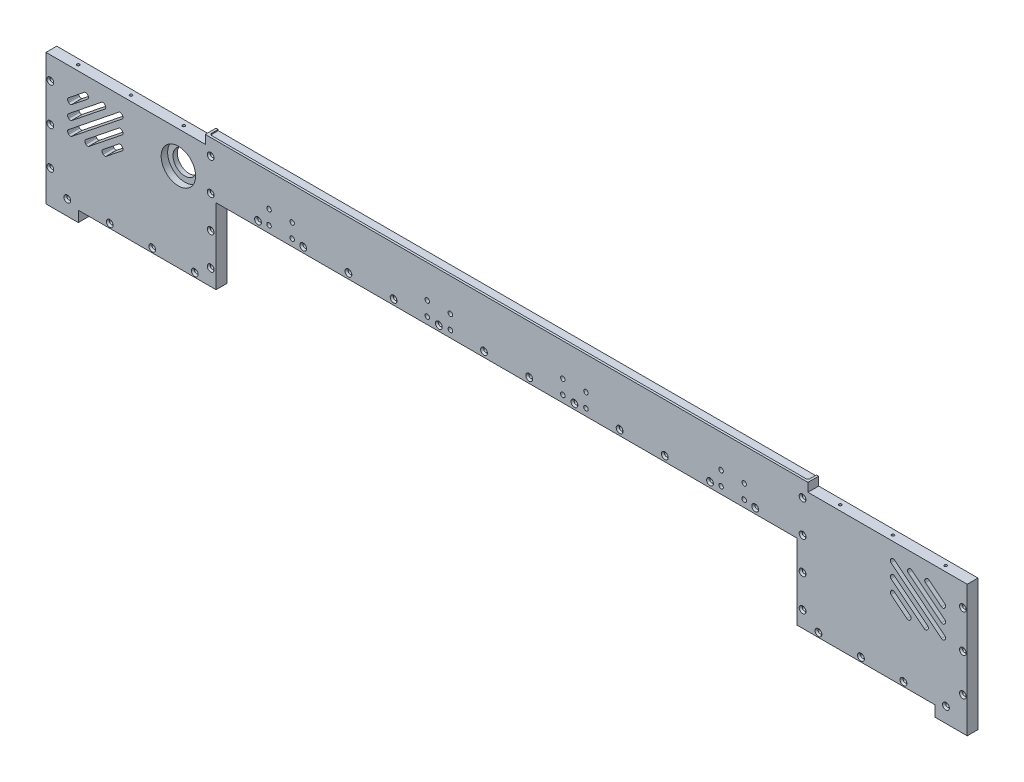
from build123d import *

# Parameters (mm, degrees)
BOSS_EXTRUDE1_DEPTH                          = 10
M3X0_5_TAPPED_HOLE1_AT_2_COUNT               = 2
M3X0_5_TAPPED_HOLE1_AT_2_PITCH               = 49
M3X0_5_TAPPED_HOLE1_AT_3_COUNT               = 2
M3X0_5_TAPPED_HOLE1_AT_3_PITCH               = 98
CSK_FOR_M3_COUNTERSUNK_FLAT_HEAD1_AT_2_COUNT = 2
CSK_FOR_M3_COUNTERSUNK_FLAT_HEAD1_AT_2_PITCH = 39.5
CSK_FOR_M3_COUNTERSUNK_FLAT_HEAD1_AT_3_COUNT = 2
CSK_FOR_M3_COUNTERSUNK_FLAT_HEAD1_AT_3_PITCH = 79
CSK_FOR_M3_COUNTERSUNK_FLAT_HEAD1_AT_4_COUNT = 2
CSK_FOR_M3_COUNTERSUNK_FLAT_HEAD1_AT_4_PITCH = 118.5
CSK_FOR_M3_COUNTERSUNK_FLAT_HEAD2_AT_2_COUNT = 2
CSK_FOR_M3_COUNTERSUNK_FLAT_HEAD2_AT_2_PITCH = 35
CSK_FOR_M3_COUNTERSUNK_FLAT_HEAD2_AT_3_COUNT = 2
CSK_FOR_M3_COUNTERSUNK_FLAT_HEAD2_AT_3_PITCH = 70
CSK_FOR_M3_COUNTERSUNK_FLAT_HEAD3_AT_2_COUNT = 2
CSK_FOR_M3_COUNTERSUNK_FLAT_HEAD3_AT_2_PITCH = 30
CSK_FOR_M3_COUNTERSUNK_FLAT_HEAD3_AT_3_COUNT = 2
CSK_FOR_M3_COUNTERSUNK_FLAT_HEAD3_AT_3_PITCH = 60
CSK_FOR_M3_COUNTERSUNK_FLAT_HEAD3_AT_4_COUNT = 2
CSK_FOR_M3_COUNTERSUNK_FLAT_HEAD3_AT_4_PITCH = 90
CSK_FOR_M3_COUNTERSUNK_FLAT_HEAD4_AT_2_COUNT = 2
CSK_FOR_M3_COUNTERSUNK_FLAT_HEAD4_AT_2_PITCH = 42
CSK_FOR_M3_COUNTERSUNK_FLAT_HEAD4_AT_3_COUNT = 2
CSK_FOR_M3_COUNTERSUNK_FLAT_HEAD4_AT_3_PITCH = 84
CSK_FOR_M3_COUNTERSUNK_FLAT_HEAD4_AT_4_COUNT = 2
CSK_FOR_M3_COUNTERSUNK_FLAT_HEAD4_AT_4_PITCH = 126
CSK_FOR_M3_COUNTERSUNK_FLAT_HEAD4_AT_5_COUNT = 2
CSK_FOR_M3_COUNTERSUNK_FLAT_HEAD4_AT_5_PITCH = 168
CSK_FOR_M3_COUNTERSUNK_FLAT_HEAD4_AT_6_COUNT = 2
CSK_FOR_M3_COUNTERSUNK_FLAT_HEAD4_AT_6_PITCH = 210
SKETCH14_W                                   = 556
SKETCH14_H                                   = 8
CUT_EXTRUDE1_DEPTH                           = 1
FILLET1_R                                    = 2
SKETCH15_R                                   = 16
CUT_EXTRUDE2_DEPTH                           = 6
SKETCH16_R                                   = 11
CUT_EXTRUDE3_DEPTH                           = 436.453786297
M5X0_8_TAPPED_HOLE1_D                        = 4.2
LPATTERN3_COUNT                              = 2
LPATTERN3_PITCH                              = 147
MIRROR2_COPY_1_D                             = 4.2
CUT_EXTRUDE_THIN1_START                      = -10
CUT_EXTRUDE_THIN1_DEPTH                      = 446.527266655
FILLET2_R                                    = 2
FILLET2_OF_MIRROR3_R                         = 2


with BuildPart() as part:
    # Sketch1 → Boss-Extrude1 (new body)
    with BuildSketch(Plane.XY):
        Polygon((270, 0), (-270, 0), (-270, -70), (-398, -70), (-398, -80), (-428, -80), (-428, 42), (-280, 42), (-280, 50), (280, 50), (280, 42), (428, 42), (428, -80), (398, -80), (398, -70), (270, -70), align=None)
    extrude(amount=BOSS_EXTRUDE1_DEPTH)

    # Sketch4 → M3x0.5 Tapped Hole1 (revolve, cut)
    with BuildSketch(Plane(origin=(-403, 42, 5), x_dir=(0, 0, 1), z_dir=(1, 0, 0))):
        Polygon((0, 0), (0, 12.251075774), (1.25, 11.5), (1.25, 0), align=None)
    m3x0_5_tapped_hole1 = revolve(axis=Axis((-403, 48.35, 5), (0, -1, 0)), mode=Mode.SUBTRACT)

    # M3x0.5 Tapped Hole1 at 2: M3x0.5 Tapped Hole1 ×2
    with Locations(*[(i * M3X0_5_TAPPED_HOLE1_AT_2_PITCH, 0, 0) for i in range(1, M3X0_5_TAPPED_HOLE1_AT_2_COUNT)]):
        add(m3x0_5_tapped_hole1, mode=Mode.SUBTRACT)

    # M3x0.5 Tapped Hole1 at 3: M3x0.5 Tapped Hole1 ×2
    with Locations(*[(i * M3X0_5_TAPPED_HOLE1_AT_3_PITCH, 0, 0) for i in range(1, M3X0_5_TAPPED_HOLE1_AT_3_COUNT)]):
        add(m3x0_5_tapped_hole1, mode=Mode.SUBTRACT)

    # Sketch6 → CSK for M3 Countersunk Flat Head1 (revolve, cut)
    with BuildSketch(Plane(origin=(-408.25, -66, 10), x_dir=(0, -1, 0), z_dir=(1, 0, 0))):
        Polygon((0, 0), (0, 12.521463052), (1.7, 11.5), (1.7, 1.45), (3.15, 0), align=None)
    csk_for_m3_countersunk_flat_head1 = revolve(axis=Axis((-408.25, -66, 16.35), (0, 0, -1)), mode=Mode.SUBTRACT)

    # CSK for M3 Countersunk Flat Head1 at 2: CSK for M3 Countersunk Flat Head1 ×2
    with Locations(*[(i * CSK_FOR_M3_COUNTERSUNK_FLAT_HEAD1_AT_2_PITCH, 0, 0) for i in range(1, CSK_FOR_M3_COUNTERSUNK_FLAT_HEAD1_AT_2_COUNT)]):
        add(csk_for_m3_countersunk_flat_head1, mode=Mode.SUBTRACT)

    # CSK for M3 Countersunk Flat Head1 at 3: CSK for M3 Countersunk Flat Head1 ×2
    with Locations(*[(i * CSK_FOR_M3_COUNTERSUNK_FLAT_HEAD1_AT_3_PITCH, 0, 0) for i in range(1, CSK_FOR_M3_COUNTERSUNK_FLAT_HEAD1_AT_3_COUNT)]):
        add(csk_for_m3_countersunk_flat_head1, mode=Mode.SUBTRACT)

    # CSK for M3 Countersunk Flat Head1 at 4: CSK for M3 Countersunk Flat Head1 ×2
    with Locations(*[(i * CSK_FOR_M3_COUNTERSUNK_FLAT_HEAD1_AT_4_PITCH, 0, 0) for i in range(1, CSK_FOR_M3_COUNTERSUNK_FLAT_HEAD1_AT_4_COUNT)]):
        add(csk_for_m3_countersunk_flat_head1, mode=Mode.SUBTRACT)

    # Sketch8 → CSK for M3 Countersunk Flat Head2 (revolve, cut)
    with BuildSketch(Plane(origin=(-424, 21, 10), x_dir=(0, -1, 0), z_dir=(1, 0, 0))):
        Polygon((0, 0), (0, 12.521463052), (1.7, 11.5), (1.7, 1.45), (3.15, 0), align=None)
    csk_for_m3_countersunk_flat_head2 = revolve(axis=Axis((-424, 21, 16.35), (0, 0, -1)), mode=Mode.SUBTRACT)

    # CSK for M3 Countersunk Flat Head2 at 2: CSK for M3 Countersunk Flat Head2 ×2
    with Locations(*[(0, -i * CSK_FOR_M3_COUNTERSUNK_FLAT_HEAD2_AT_2_PITCH, 0) for i in range(1, CSK_FOR_M3_COUNTERSUNK_FLAT_HEAD2_AT_2_COUNT)]):
        add(csk_for_m3_countersunk_flat_head2, mode=Mode.SUBTRACT)

    # CSK for M3 Countersunk Flat Head2 at 3: CSK for M3 Countersunk Flat Head2 ×2
    with Locations(*[(0, -i * CSK_FOR_M3_COUNTERSUNK_FLAT_HEAD2_AT_3_PITCH, 0) for i in range(1, CSK_FOR_M3_COUNTERSUNK_FLAT_HEAD2_AT_3_COUNT)]):
        add(csk_for_m3_countersunk_flat_head2, mode=Mode.SUBTRACT)

    # Sketch11 → CSK for M3 Countersunk Flat Head3 (revolve, cut)
    with BuildSketch(Plane(origin=(-275, 35, 10), x_dir=(0, -1, 0), z_dir=(1, 0, 0))):
        Polygon((0, 0), (0, 12.521463052), (1.7, 11.5), (1.7, 1.45), (3.15, 0), align=None)
    csk_for_m3_countersunk_flat_head3 = revolve(axis=Axis((-275, 35, 16.35), (0, 0, -1)), mode=Mode.SUBTRACT)

    # CSK for M3 Countersunk Flat Head3 at 2: CSK for M3 Countersunk Flat Head3 ×2
    with Locations(*[(0, -i * CSK_FOR_M3_COUNTERSUNK_FLAT_HEAD3_AT_2_PITCH, 0) for i in range(1, CSK_FOR_M3_COUNTERSUNK_FLAT_HEAD3_AT_2_COUNT)]):
        add(csk_for_m3_countersunk_flat_head3, mode=Mode.SUBTRACT)

    # CSK for M3 Countersunk Flat Head3 at 3: CSK for M3 Countersunk Flat Head3 ×2
    with Locations(*[(0, -i * CSK_FOR_M3_COUNTERSUNK_FLAT_HEAD3_AT_3_PITCH, 0) for i in range(1, CSK_FOR_M3_COUNTERSUNK_FLAT_HEAD3_AT_3_COUNT)]):
        add(csk_for_m3_countersunk_flat_head3, mode=Mode.SUBTRACT)

    # CSK for M3 Countersunk Flat Head3 at 4: CSK for M3 Countersunk Flat Head3 ×2
    with Locations(*[(0, -i * CSK_FOR_M3_COUNTERSUNK_FLAT_HEAD3_AT_4_PITCH, 0) for i in range(1, CSK_FOR_M3_COUNTERSUNK_FLAT_HEAD3_AT_4_COUNT)]):
        add(csk_for_m3_countersunk_flat_head3, mode=Mode.SUBTRACT)

    # Sketch13 → CSK for M3 Countersunk Flat Head4 (revolve, cut)
    with BuildSketch(Plane(origin=(-231, 5, 10), x_dir=(0, -1, 0), z_dir=(1, 0, 0))):
        Polygon((0, 0), (0, 12.521463052), (1.7, 11.5), (1.7, 1.45), (3.15, 0), align=None)
    csk_for_m3_countersunk_flat_head4 = revolve(axis=Axis((-231, 5, 16.35), (0, 0, -1)), mode=Mode.SUBTRACT)

    # CSK for M3 Countersunk Flat Head4 at 2: CSK for M3 Countersunk Flat Head4 ×2
    with Locations(*[(i * CSK_FOR_M3_COUNTERSUNK_FLAT_HEAD4_AT_2_PITCH, 0, 0) for i in range(1, CSK_FOR_M3_COUNTERSUNK_FLAT_HEAD4_AT_2_COUNT)]):
        add(csk_for_m3_countersunk_flat_head4, mode=Mode.SUBTRACT)

    # CSK for M3 Countersunk Flat Head4 at 3: CSK for M3 Countersunk Flat Head4 ×2
    with Locations(*[(i * CSK_FOR_M3_COUNTERSUNK_FLAT_HEAD4_AT_3_PITCH, 0, 0) for i in range(1, CSK_FOR_M3_COUNTERSUNK_FLAT_HEAD4_AT_3_COUNT)]):
        add(csk_for_m3_countersunk_flat_head4, mode=Mode.SUBTRACT)

    # CSK for M3 Countersunk Flat Head4 at 4: CSK for M3 Countersunk Flat Head4 ×2
    with Locations(*[(i * CSK_FOR_M3_COUNTERSUNK_FLAT_HEAD4_AT_4_PITCH, 0, 0) for i in range(1, CSK_FOR_M3_COUNTERSUNK_FLAT_HEAD4_AT_4_COUNT)]):
        add(csk_for_m3_countersunk_flat_head4, mode=Mode.SUBTRACT)

    # CSK for M3 Countersunk Flat Head4 at 5: CSK for M3 Countersunk Flat Head4 ×2
    with Locations(*[(i * CSK_FOR_M3_COUNTERSUNK_FLAT_HEAD4_AT_5_PITCH, 0, 0) for i in range(1, CSK_FOR_M3_COUNTERSUNK_FLAT_HEAD4_AT_5_COUNT)]):
        add(csk_for_m3_countersunk_flat_head4, mode=Mode.SUBTRACT)

    # CSK for M3 Countersunk Flat Head4 at 6: CSK for M3 Countersunk Flat Head4 ×2
    with Locations(*[(i * CSK_FOR_M3_COUNTERSUNK_FLAT_HEAD4_AT_6_PITCH, 0, 0) for i in range(1, CSK_FOR_M3_COUNTERSUNK_FLAT_HEAD4_AT_6_COUNT)]):
        add(csk_for_m3_countersunk_flat_head4, mode=Mode.SUBTRACT)

    # Mirror1: M3x0.5 Tapped Hole1, CSK for M3 Countersunk Flat Head1, CSK for M3 Countersunk Flat Head2, CSK for M3 Countersunk Flat Head3, CSK for M3 Countersunk Flat Head4 across plane
    add(m3x0_5_tapped_hole1.mirror(Plane(origin=(0, 0, 0), x_dir=(0, 0, 1), z_dir=(1, 0, 0))), mode=Mode.SUBTRACT)
    add(csk_for_m3_countersunk_flat_head1.mirror(Plane(origin=(0, 0, 0), x_dir=(0, 0, 1), z_dir=(1, 0, 0))), mode=Mode.SUBTRACT)
    add(csk_for_m3_countersunk_flat_head2.mirror(Plane(origin=(0, 0, 0), x_dir=(0, 0, 1), z_dir=(1, 0, 0))), mode=Mode.SUBTRACT)
    add(csk_for_m3_countersunk_flat_head3.mirror(Plane(origin=(0, 0, 0), x_dir=(0, 0, 1), z_dir=(1, 0, 0))), mode=Mode.SUBTRACT)
    add(csk_for_m3_countersunk_flat_head4.mirror(Plane(origin=(0, 0, 0), x_dir=(0, 0, 1), z_dir=(1, 0, 0))), mode=Mode.SUBTRACT)

    # Mirror1 copy 1 sketch → Mirror1 copy 1 (revolve, cut)
    with BuildSketch(Plane(origin=(354, 42, 5), x_dir=(0, 0, 1), z_dir=(-1, 0, 0))):
        Polygon((0, 0), (0, -12.251075774), (1.25, -11.5), (1.25, 0), align=None)
    revolve(axis=Axis((354, 48.35, 5), (0, 1, 0)), mode=Mode.SUBTRACT)

    # Mirror1 copy 2 sketch → Mirror1 copy 2 (revolve, cut)
    with BuildSketch(Plane(origin=(305, 42, 5), x_dir=(0, 0, 1), z_dir=(-1, 0, 0))):
        Polygon((0, 0), (0, -12.251075774), (1.25, -11.5), (1.25, 0), align=None)
    revolve(axis=Axis((305, 48.35, 5), (0, 1, 0)), mode=Mode.SUBTRACT)

    # Mirror1 copy 3 sketch → Mirror1 copy 3 (revolve, cut)
    with BuildSketch(Plane(origin=(368.75, -66, 10), x_dir=(0, -1, 0), z_dir=(-1, 0, 0))):
        Polygon((0, 0), (0, -12.521463052), (1.7, -11.5), (1.7, -1.45), (3.15, 0), align=None)
    revolve(axis=Axis((368.75, -66, 16.35), (0, 0, 1)), mode=Mode.SUBTRACT)

    # Mirror1 copy 4 sketch → Mirror1 copy 4 (revolve, cut)
    with BuildSketch(Plane(origin=(329.25, -66, 10), x_dir=(0, -1, 0), z_dir=(-1, 0, 0))):
        Polygon((0, 0), (0, -12.521463052), (1.7, -11.5), (1.7, -1.45), (3.15, 0), align=None)
    revolve(axis=Axis((329.25, -66, 16.35), (0, 0, 1)), mode=Mode.SUBTRACT)

    # Mirror1 copy 5 sketch → Mirror1 copy 5 (revolve, cut)
    with BuildSketch(Plane(origin=(289.75, -66, 10), x_dir=(0, -1, 0), z_dir=(-1, 0, 0))):
        Polygon((0, 0), (0, -12.521463052), (1.7, -11.5), (1.7, -1.45), (3.15, 0), align=None)
    revolve(axis=Axis((289.75, -66, 16.35), (0, 0, 1)), mode=Mode.SUBTRACT)

    # Mirror1 copy 6 sketch → Mirror1 copy 6 (revolve, cut)
    with BuildSketch(Plane(origin=(424, -14, 10), x_dir=(0, -1, 0), z_dir=(-1, 0, 0))):
        Polygon((0, 0), (0, -12.521463052), (1.7, -11.5), (1.7, -1.45), (3.15, 0), align=None)
    revolve(axis=Axis((424, -14, 16.35), (0, 0, 1)), mode=Mode.SUBTRACT)

    # Mirror1 copy 7 sketch → Mirror1 copy 7 (revolve, cut)
    with BuildSketch(Plane(origin=(424, -49, 10), x_dir=(0, -1, 0), z_dir=(-1, 0, 0))):
        Polygon((0, 0), (0, -12.521463052), (1.7, -11.5), (1.7, -1.45), (3.15, 0), align=None)
    revolve(axis=Axis((424, -49, 16.35), (0, 0, 1)), mode=Mode.SUBTRACT)

    # Mirror1 copy 8 sketch → Mirror1 copy 8 (revolve, cut)
    with BuildSketch(Plane(origin=(275, 5, 10), x_dir=(0, -1, 0), z_dir=(-1, 0, 0))):
        Polygon((0, 0), (0, -12.521463052), (1.7, -11.5), (1.7, -1.45), (3.15, 0), align=None)
    revolve(axis=Axis((275, 5, 16.35), (0, 0, 1)), mode=Mode.SUBTRACT)

    # Mirror1 copy 9 sketch → Mirror1 copy 9 (revolve, cut)
    with BuildSketch(Plane(origin=(275, -25, 10), x_dir=(0, -1, 0), z_dir=(-1, 0, 0))):
        Polygon((0, 0), (0, -12.521463052), (1.7, -11.5), (1.7, -1.45), (3.15, 0), align=None)
    revolve(axis=Axis((275, -25, 16.35), (0, 0, 1)), mode=Mode.SUBTRACT)

    # Mirror1 copy 10 sketch → Mirror1 copy 10 (revolve, cut)
    with BuildSketch(Plane(origin=(275, -55, 10), x_dir=(0, -1, 0), z_dir=(-1, 0, 0))):
        Polygon((0, 0), (0, -12.521463052), (1.7, -11.5), (1.7, -1.45), (3.15, 0), align=None)
    revolve(axis=Axis((275, -55, 16.35), (0, 0, 1)), mode=Mode.SUBTRACT)

    # Mirror1 copy 11 sketch → Mirror1 copy 11 (revolve, cut)
    with BuildSketch(Plane(origin=(189, 5, 10), x_dir=(0, -1, 0), z_dir=(-1, 0, 0))):
        Polygon((0, 0), (0, -12.521463052), (1.7, -11.5), (1.7, -1.45), (3.15, 0), align=None)
    revolve(axis=Axis((189, 5, 16.35), (0, 0, 1)), mode=Mode.SUBTRACT)

    # Mirror1 copy 12 sketch → Mirror1 copy 12 (revolve, cut)
    with BuildSketch(Plane(origin=(147, 5, 10), x_dir=(0, -1, 0), z_dir=(-1, 0, 0))):
        Polygon((0, 0), (0, -12.521463052), (1.7, -11.5), (1.7, -1.45), (3.15, 0), align=None)
    revolve(axis=Axis((147, 5, 16.35), (0, 0, 1)), mode=Mode.SUBTRACT)

    # Mirror1 copy 13 sketch → Mirror1 copy 13 (revolve, cut)
    with BuildSketch(Plane(origin=(105, 5, 10), x_dir=(0, -1, 0), z_dir=(-1, 0, 0))):
        Polygon((0, 0), (0, -12.521463052), (1.7, -11.5), (1.7, -1.45), (3.15, 0), align=None)
    revolve(axis=Axis((105, 5, 16.35), (0, 0, 1)), mode=Mode.SUBTRACT)

    # Mirror1 copy 14 sketch → Mirror1 copy 14 (revolve, cut)
    with BuildSketch(Plane(origin=(63, 5, 10), x_dir=(0, -1, 0), z_dir=(-1, 0, 0))):
        Polygon((0, 0), (0, -12.521463052), (1.7, -11.5), (1.7, -1.45), (3.15, 0), align=None)
    revolve(axis=Axis((63, 5, 16.35), (0, 0, 1)), mode=Mode.SUBTRACT)

    # Mirror1 copy 15 sketch → Mirror1 copy 15 (revolve, cut)
    with BuildSketch(Plane(origin=(21, 5, 10), x_dir=(0, -1, 0), z_dir=(-1, 0, 0))):
        Polygon((0, 0), (0, -12.521463052), (1.7, -11.5), (1.7, -1.45), (3.15, 0), align=None)
    revolve(axis=Axis((21, 5, 16.35), (0, 0, 1)), mode=Mode.SUBTRACT)

    # Sketch14 → Cut-Extrude1 (cut)
    with BuildSketch(Plane(origin=(0, 50, 0), x_dir=(1, 0, 0), z_dir=(0, 1, 0))):
        with Locations((0, -4)):
            Rectangle(SKETCH14_W, SKETCH14_H)
    extrude(amount=-CUT_EXTRUDE1_DEPTH, mode=Mode.SUBTRACT)

    # Fillet1
    fillet1_edges = [part.edges().sort_by_distance(p)[0] for p in [
        (-278, 49.5, 8),
        (278, 49.5, 8),
    ]]
    fillet(fillet1_edges, radius=FILLET1_R)

    # Sketch15 → Cut-Extrude2 (cut)
    with BuildSketch(Plane.XY.offset(10)):
        with Locations((-305, 12)):
            Circle(SKETCH15_R)
    extrude(amount=-CUT_EXTRUDE2_DEPTH, mode=Mode.SUBTRACT)

    # Sketch16 → Cut-Extrude3 (cut, through all)
    with BuildSketch(Plane.XY.offset(4)):
        with Locations((-305, 12)):
            Circle(SKETCH16_R)
    extrude(amount=-CUT_EXTRUDE3_DEPTH, mode=Mode.SUBTRACT)

    # M5x0.8 Tapped Hole1 (through all)
    with Locations(Plane(origin=(-52.25, 19.5, 10), x_dir=(1, 0, 0), z_dir=(0, 0, 1))):
        with Locations((0, 0), (-21.5, 0), (-21.5, -13), (0, -13)):
            m5x0_8_tapped_hole1 = Hole(M5X0_8_TAPPED_HOLE1_D / 2)

    # LPattern3: M5x0.8 Tapped Hole1 ×2
    with Locations(*[(-i * LPATTERN3_PITCH, 0, 0) for i in range(1, LPATTERN3_COUNT)]):
        add(m5x0_8_tapped_hole1, mode=Mode.SUBTRACT)

    # Mirror2: M5x0.8 Tapped Hole1 across plane
    add(m5x0_8_tapped_hole1.mirror(Plane(origin=(0, 0, 0), x_dir=(0, 0, 1), z_dir=(1, 0, 0))), mode=Mode.SUBTRACT)

    # Mirror2 copy 1 (through all)
    with Locations(Plane(origin=(199.25, 19.5, 10), x_dir=(-1, 0, 0), z_dir=(0, 0, 1))):
        with Locations((0, 0), (-21.5, 0), (-21.5, 13), (0, 13)):
            Hole(MIRROR2_COPY_1_D / 2)

    # Sketch19 → Cut-Extrude-Thin1 (cut)
    with BuildSketch(Plane.XY.offset(10).offset(CUT_EXTRUDE_THIN1_START)):
        Polygon((-358.772487848, 28.952172024), (-408.772487848, -11.047827976), (-405.64901261, -14.952172024), (-355.64901261, 25.047827976), align=None)
        Polygon((-374.780298442, 28.952172024), (-408.772487848, 1.758420498), (-405.64901261, -2.145923549), (-371.656823204, 25.047827976), align=None)
        Polygon((-390.788109035, 28.952172024), (-408.772487848, 14.564668973), (-405.64901261, 10.660324926), (-387.664633797, 25.047827976), align=None)
        Polygon((-389.641202017, -14.952172024), (-355.64901261, 12.241579502), (-358.772487848, 16.145923549), (-392.764677254, -11.047827976), align=None)
        Polygon((-358.772487848, 3.339675074), (-376.756866661, -11.047827976), (-373.633391423, -14.952172024), (-355.64901261, -0.564668973), align=None)
    cut_extrude_thin1 = extrude(amount=CUT_EXTRUDE_THIN1_DEPTH, mode=Mode.SUBTRACT)

    # Fillet2
    fillet2_edges = [part.edges().sort_by_distance(p)[0] for p in [
        (-376.756866661, -11.047827976, 5),
        (-358.772487848, 3.339675074, 5),
        (-355.64901261, -0.564668973, 5),
        (-373.633391423, -14.952172024, 5),
        (-408.772487848, 1.758420498, 5),
        (-374.780298442, 28.952172024, 5),
        (-371.656823204, 25.047827976, 5),
        (-405.64901261, -2.145923549, 5),
        (-355.64901261, 12.241579502, 5),
        (-389.641202017, -14.952172024, 5),
        (-392.764677254, -11.047827976, 5),
        (-358.772487848, 16.145923549, 5),
        (-408.772487848, 14.564668973, 5),
        (-390.788109035, 28.952172024, 5),
        (-387.664633797, 25.047827976, 5),
        (-405.64901261, 10.660324926, 5),
        (-358.772487848, 28.952172024, 5),
        (-408.772487848, -11.047827976, 5),
        (-405.64901261, -14.952172024, 5),
        (-355.64901261, 25.047827976, 5),
    ]]
    fillet(fillet2_edges, radius=FILLET2_R)

    # Mirror3: Cut-Extrude-Thin1 across plane
    add(cut_extrude_thin1.mirror(Plane(origin=(0, 0, 0), x_dir=(0, 0, 1), z_dir=(1, 0, 0))), mode=Mode.SUBTRACT)

    # Fillet2 of Mirror3
    fillet2_of_mirror3_edges = [part.edges().sort_by_distance(p)[0] for p in [
        (376.756866661, -11.047827976, 5),
        (358.772487848, 3.339675074, 5),
        (355.64901261, -0.564668973, 5),
        (373.633391423, -14.952172024, 5),
        (408.772487848, 1.758420498, 5),
        (374.780298442, 28.952172024, 5),
        (371.656823204, 25.047827976, 5),
        (405.64901261, -2.145923549, 5),
        (355.64901261, 12.241579502, 5),
        (389.641202017, -14.952172024, 5),
        (392.764677254, -11.047827976, 5),
        (358.772487848, 16.145923549, 5),
        (408.772487848, 14.564668973, 5),
        (390.788109035, 28.952172024, 5),
        (387.664633797, 25.047827976, 5),
        (405.64901261, 10.660324926, 5),
        (358.772487848, 28.952172024, 5),
        (408.772487848, -11.047827976, 5),
        (405.64901261, -14.952172024, 5),
        (355.64901261, 25.047827976, 5),
    ]]
    fillet(fillet2_of_mirror3_edges, radius=FILLET2_OF_MIRROR3_R)


solid = part.part
